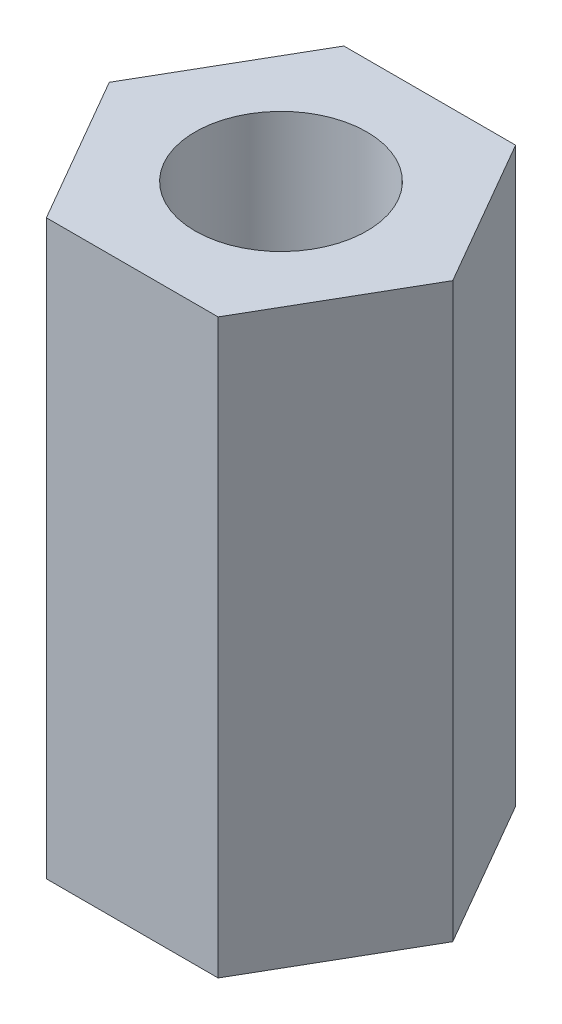
from build123d import *

# Parameters (mm, degrees)
SKETCH1_R           = 1.5
BOSS_EXTRUDE1_DEPTH = 10


with BuildPart() as part:
    # Sketch1 → Boss-Extrude1 (new body)
    with BuildSketch(Plane(origin=(0, 0, 0), x_dir=(1, 0, 0), z_dir=(0, 1, 0))):
        Polygon((-1.5, 2.598076211), (-3, 0), (-1.5, -2.598076211), (1.5, -2.598076211), (3, 0), (1.5, 2.598076211), align=None)
        with Locations(Location((0, 0, 0), (0, 0, 270))):
            Circle(SKETCH1_R, mode=Mode.SUBTRACT)
    extrude(amount=BOSS_EXTRUDE1_DEPTH)


solid = part.part
